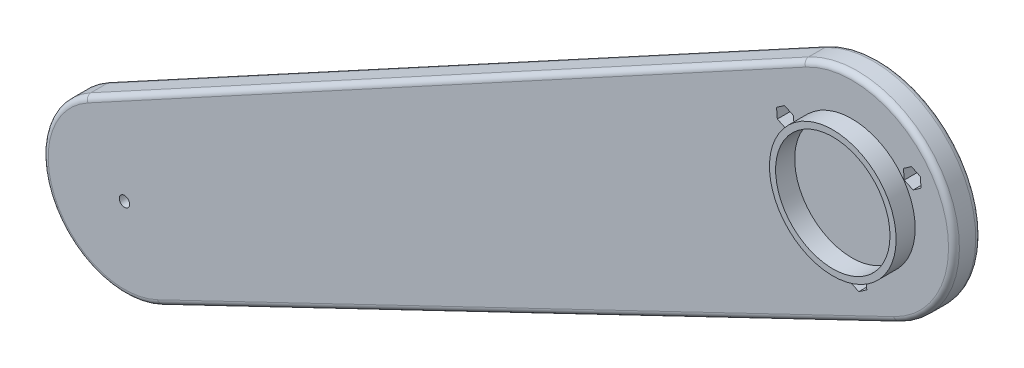
from build123d import *

# Parameters (mm, degrees)
BOSS_EXTRUDE1_DEPTH = 10
FILLET1_R           = 2
SKETCH3_R           = 1.9
CUT_EXTRUDE3_DEPTH  = 240
CUT_EXTRUDE4_DEPTH  = 5
SKETCH6_R           = 1.75
CUT_EXTRUDE8_DEPTH  = 10
SKETCH7_R           = 23.25
SKETCH7_R_2         = 21
BOSS_EXTRUDE2_DEPTH = 7
CUT_EXTRUDE9_DEPTH  = 5


with BuildPart() as part:
    # Sketch1 → Boss-Extrude1 (new body)
    with BuildSketch(Plane.XY):
        with BuildLine():
            Line((-281.432373232, -110.20807274), (-17.900575614, 32.951773741))
            ThreePointArc((-17.900575614, 32.951773741), (33.388989093, 17.071186467), (16.23112616, -33.805333064))
            Line((16.23112616, -33.805333064), (-254.127011813, -163.613758184))
            ThreePointArc((-254.127011813, -163.613758184), (-293.823104015, -150.226440906), (-281.432373232, -110.20807274))
        make_face()
    extrude(amount=BOSS_EXTRUDE1_DEPTH)

    # Fillet1
    fillet1_edges = [part.edges().sort_by_distance(p)[0] for p in [
        (33.388989093, 17.071186467, 10),
        (-149.666474423, -38.628149499, 10),
        (-293.823104015, -150.226440906, 10),
        (-149.666474423, -38.628149499, 0),
        (33.388989093, 17.071186467, 0),
        (-118.947942827, -98.709545624, 0),
        (-293.823104015, -150.226440906, 0),
        (-118.947942827, -98.709545624, 10),
    ]]
    fillet(fillet1_edges, radius=FILLET1_R)

    # Sketch3 → Cut-Extrude3 (cut)
    with BuildSketch(Plane.XY.offset(10)):
        with Locations((-267.111912741, -136.569491732)):
            Circle(SKETCH3_R)
    extrude(amount=-CUT_EXTRUDE3_DEPTH, mode=Mode.SUBTRACT)

    # Sketch4 → Cut-Extrude4 (cut)
    with BuildSketch(Plane.XY.offset(10)):
        Polygon((1.949051074, -23.338757463), (-0.99159812, -25.380566053), (-0.693664608, -28.948147254), (2.544918098, -30.473919864), (5.485567292, -28.432111274), (5.18763378, -24.864530073), align=None)
        Polygon((19.237431318, 13.357306475), (22.476014024, 11.831533865), (25.416663218, 13.873342455), (25.118729706, 17.440923655), (21.880147001, 18.966696266), (18.939497807, 16.924887676), align=None)
        Polygon((-21.186482393, 9.981450988), (-21.484415905, 13.549032188), (-24.72299861, 15.074804799), (-27.663647804, 13.032996209), (-27.365714292, 9.465415008), (-24.127131587, 7.939642398), align=None)
    extrude(amount=-CUT_EXTRUDE4_DEPTH, mode=Mode.SUBTRACT)

    # Sketch6 → Cut-Extrude8 (cut)
    with BuildSketch(Plane.XY.offset(10)):
        with Locations((2.246984586, -26.906338663)):
            Circle(SKETCH6_R)
        with Locations((-24.425065098, 11.507223598)):
            Circle(SKETCH6_R)
        with Locations((22.178080512, 15.399115065)):
            Circle(SKETCH6_R)
    extrude(amount=-CUT_EXTRUDE8_DEPTH, mode=Mode.SUBTRACT)

    # Sketch7 → Boss-Extrude2 (add)
    with BuildSketch(Plane.XY.offset(10)):
        Circle(SKETCH7_R)
        Circle(SKETCH7_R_2, mode=Mode.SUBTRACT)
    extrude(amount=BOSS_EXTRUDE2_DEPTH)

    # Sketch8 → Cut-Extrude9 (cut)
    with BuildSketch(Plane(origin=(0, 0, 0), x_dir=(-1, 0, 0), z_dir=(0, 0, -1))):
        Polygon((270.635063904, -137.204948955), (269.42381042, -133.836081935), (265.900659257, -133.200624712), (263.588761578, -135.93403451), (264.800015061, -139.30290153), (268.323166224, -139.938358752), align=None)
    extrude(amount=-CUT_EXTRUDE9_DEPTH, mode=Mode.SUBTRACT)


solid = part.part
